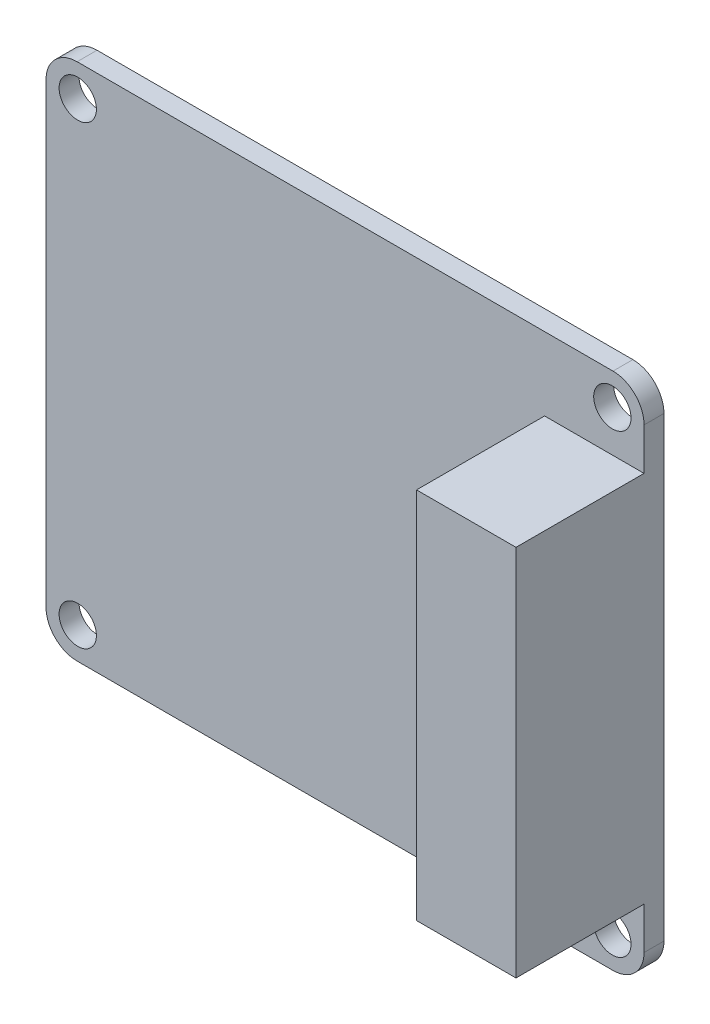
from build123d import *

# Parameters (mm, degrees)
SKETCH1_R           = 1.5
BOSS_EXTRUDE1_DEPTH = 1.6
SKETCH1_3_W         = 30
SKETCH1_3_H         = 8
BOSS_EXTRUDE2_DEPTH = 11.9


with BuildPart() as part:
    # Sketch1 → Boss-Extrude1 (new body)
    with BuildSketch(Plane(origin=(0, 0, 0), x_dir=(0, 1, 0), z_dir=(0, 0, 1))):
        with BuildLine():
            ThreePointArc((0, 2.5), (0.732233047, 0.732233047), (2.5, 0))
            Line((2.5, 0), (39.25, 0))
            ThreePointArc((39.25, 0), (41.017766953, 0.732233047), (41.75, 2.5))
            Line((41.75, 2.5), (41.75, 45.6))
            ThreePointArc((41.75, 45.6), (41.017766953, 47.367766953), (39.25, 48.1))
            Line((39.25, 48.1), (2.5, 48.1))
            ThreePointArc((2.5, 48.1), (0.732233047, 47.367766953), (0, 45.6))
            Line((0, 45.6), (0, 2.5))
        make_face()
        with Locations((2.549913685, 2.549913685)):
            Circle(SKETCH1_R, mode=Mode.SUBTRACT)
        with Locations((39.200086315, 2.549913685)):
            Circle(SKETCH1_R, mode=Mode.SUBTRACT)
        with Locations((2.549913685, 45.550086315)):
            Circle(SKETCH1_R, mode=Mode.SUBTRACT)
        with Locations((39.200086315, 45.550086315)):
            Circle(SKETCH1_R, mode=Mode.SUBTRACT)
    extrude(amount=BOSS_EXTRUDE1_DEPTH)

    # Sketch1<3> → Boss-Extrude2 (add)
    with BuildSketch(Plane(origin=(0, 0, 0), x_dir=(0, 1, 0), z_dir=(0, 0, 1))):
        with Locations((20.875, 4)):
            Rectangle(SKETCH1_3_W, SKETCH1_3_H)
    extrude(amount=BOSS_EXTRUDE2_DEPTH)


solid = part.part
